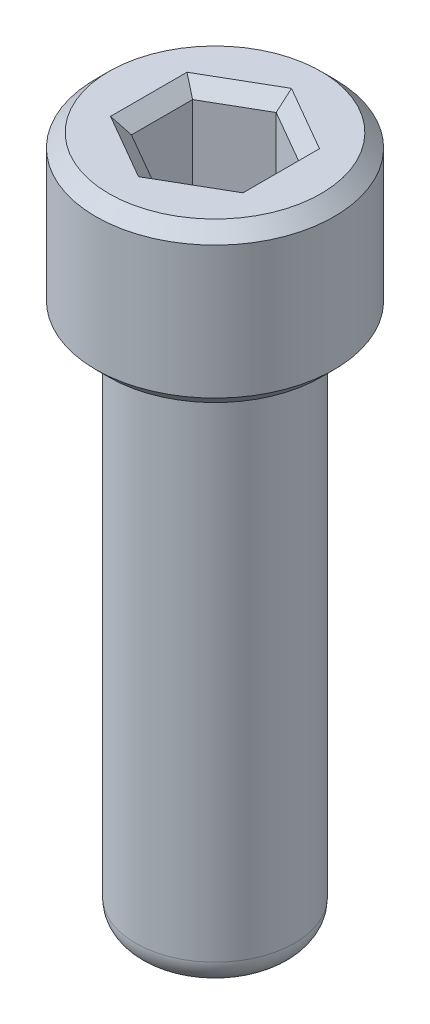
from build123d import *

# Parameters (mm, degrees)
SKETCH1_R           = 1.5
BOSS_EXTRUDE1_DEPTH = 10
SKETCH2_R           = 2.25
BOSS_EXTRUDE2_DEPTH = 3
CUT_EXTRUDE1_DEPTH  = 2
CHAMFER1_SIZE       = 0.25
FILLET1_R           = 0.5


with BuildPart() as part:
    # Sketch1 → Boss-Extrude1 (new body)
    with BuildSketch(Plane(origin=(0, 0, 0), x_dir=(1, 0, 0), z_dir=(0, 1, 0))):
        with Locations(Location((0, 0, 0), (0, 0, 270))):
            Circle(SKETCH1_R)
    extrude(amount=BOSS_EXTRUDE1_DEPTH)

    # Sketch2 → Boss-Extrude2 (add)
    with BuildSketch(Plane(origin=(0, 10, 0), x_dir=(1, 0, 0), z_dir=(0, 1, 0))):
        with Locations(Location((0, 0, 0), (0, 0, 270))):
            Circle(SKETCH2_R)
    extrude(amount=BOSS_EXTRUDE2_DEPTH)

    # Sketch3 → Cut-Extrude1 (cut)
    with BuildSketch(Plane(origin=(0, 13, 0), x_dir=(1, 0, 0), z_dir=(0, 1, 0))):
        Polygon((0, 1.154700538), (-1, 0.577350269), (-1, -0.577350269), (0, -1.154700538), (1, -0.577350269), (1, 0.577350269), align=None)
    extrude(amount=-CUT_EXTRUDE1_DEPTH, mode=Mode.SUBTRACT)

    # Chamfer1
    chamfer1_edges = [part.edges().sort_by_distance(p)[0] for p in [
        (0.5, 13, -0.866025404),
        (-0.5, 13, -0.866025404),
        (-1, 13, 0),
        (-0.5, 13, 0.866025404),
        (0.5, 13, 0.866025404),
        (1, 13, 0),
        (0, 10, -2.25),
        (0, 13, -2.25),
    ]]
    chamfer(chamfer1_edges, length=CHAMFER1_SIZE)

    # Fillet1
    fillet1_edges = [part.edges().sort_by_distance(p)[0] for p in [
        (0, 0, -1.5),
    ]]
    fillet(fillet1_edges, radius=FILLET1_R)


solid = part.part
